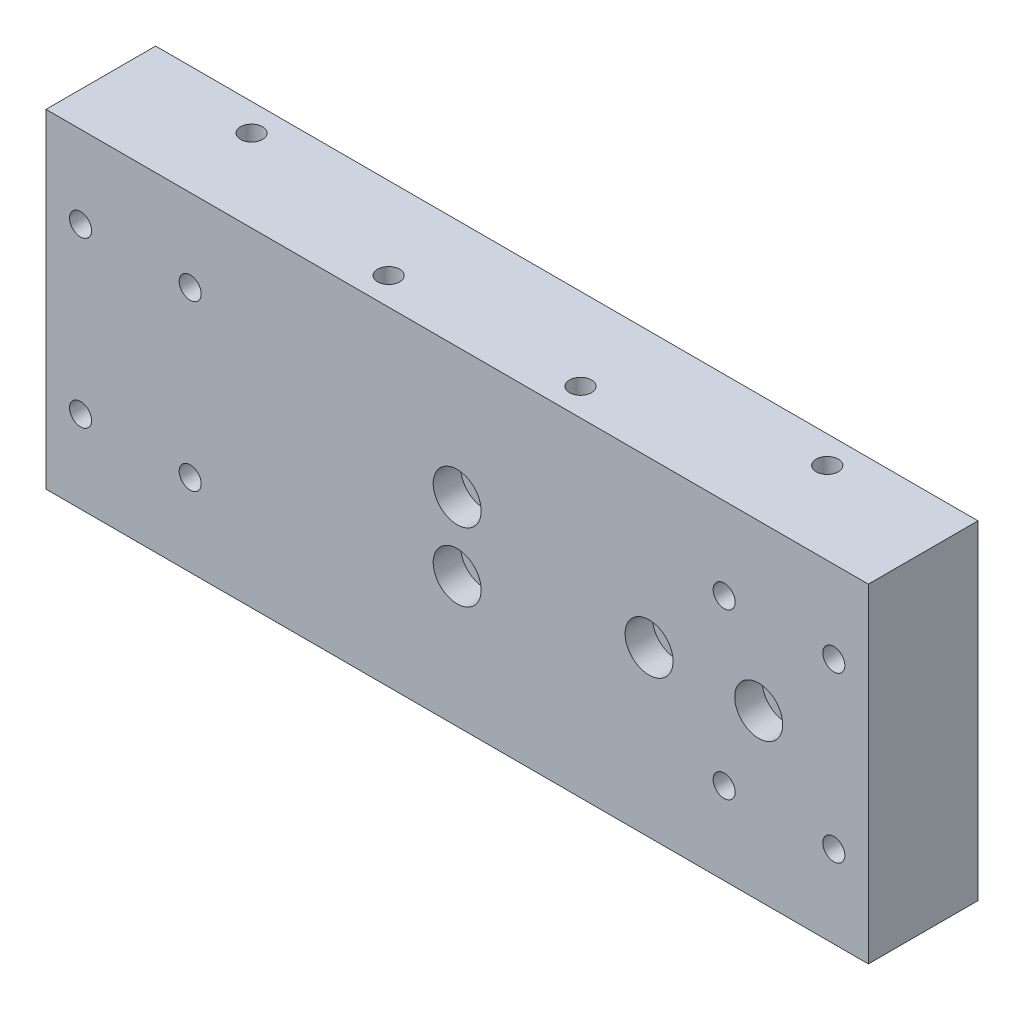
from build123d import *

# Parameters (mm, degrees)
SKETCH1_W                                            = 190.5
SKETCH1_H                                            = 76.2
EXTRUDE1_DEPTH                                       = 12.7
SIDE_1_4_20_TAPPED_HOLE_MASTER_AT_2_COUNT            = 2
SIDE_1_4_20_TAPPED_HOLE_MASTER_AT_2_PITCH            = 46.228697797
TOP_1_4_20_TAPPED_HOES_D                             = 5.1054
BUSIHING_FLEXURE_COUPLING_1_4_20_BOLT_HO_D           = 6.7564
BUSIHING_FLEXURE_COUPLING_1_4_20_BOLT_HO_CBORE_D     = 11.1125
BUSIHING_FLEXURE_COUPLING_1_4_20_BOLT_HO_CBORE_DEPTH = 6.35
LEAD_SCREW_1_4_CAP_SCREW_MOUNTS_D                    = 6.7564
LEAD_SCREW_1_4_CAP_SCREW_MOUNTS_CBORE_D              = 11.1125
LEAD_SCREW_1_4_CAP_SCREW_MOUNTS_CBORE_DEPTH          = 6.35


with BuildPart() as part:
    # Sketch1 → Extrude1 (new, symmetric)
    with BuildSketch(Plane.XY):
        Rectangle(SKETCH1_W, SKETCH1_H)
    extrude(amount=EXTRUDE1_DEPTH, both=True)

    # Sketch10 → Side-1/4-20 tapped hole master (revolve, cut)
    with BuildSketch(Plane(origin=(22.225, -38.1, 6.35), x_dir=(0, 0, -1), z_dir=(1, 0, 0))):
        Polygon((0, 0), (0, 20.583816902), (2.5527, 19.05), (2.5527, 0), align=None)
    side_1_4_20_tapped_hole_master = revolve(axis=Axis((22.225, -44.45, 6.35), (0, 1, 0)), mode=Mode.SUBTRACT)

    # Side-1/4-20 tapped hole master at 2: Side-1/4-20 tapped hole master ×2
    with Locations(*[Vector(0.9615239476408232, 0, -0.27472112789737807) * (i * SIDE_1_4_20_TAPPED_HOLE_MASTER_AT_2_PITCH) for i in range(1, SIDE_1_4_20_TAPPED_HOLE_MASTER_AT_2_COUNT)]):
        add(side_1_4_20_tapped_hole_master, mode=Mode.SUBTRACT)

    # Side-1/4-20 tapped hole mirror I: Side-1/4-20 tapped hole master across plane
    add(side_1_4_20_tapped_hole_master.mirror(Plane(origin=(0, 0, 0), x_dir=(0, 0, 1), z_dir=(1, 0, 0))), mode=Mode.SUBTRACT)

    # Side-1/4-20 tapped hole mirror I copy 1 → Side-1/4-20 tapped hole mirror I cop 2 (revolve, cut)
    with BuildSketch(Plane(origin=(-66.675, -38.1, -6.35), x_dir=(0, 0, -1), z_dir=(-1, 0, 0))):
        Polygon((0, 0), (0, -20.583816902), (2.5527, -19.05), (2.5527, 0), align=None)
    revolve(axis=Axis((-66.675, -44.45, -6.35), (0, -1, 0)), mode=Mode.SUBTRACT)

    # Side-1/4-20 tapped hole mirror II: Side-1/4-20 tapped hole master across plane
    add(side_1_4_20_tapped_hole_master.mirror(Plane.ZX), mode=Mode.SUBTRACT)

    # Side-1/4-20 tapped hole mirror II copy 1 → Side-1/4-20 tapped hole mirror II co 2 (revolve, cut)
    with BuildSketch(Plane(origin=(66.675, 38.1, -6.35), x_dir=(0, 0, -1), z_dir=(1, 0, 0))):
        Polygon((0, 0), (0, -20.583816902), (2.5527, -19.05), (2.5527, 0), align=None)
    revolve(axis=Axis((66.675, 44.45, -6.35), (0, 1, 0)), mode=Mode.SUBTRACT)

    # Side-1/4-20 tapped hole mirror II copy 2 → Side-1/4-20 tapped hole mirror II co 3 (revolve, cut)
    with BuildSketch(Plane(origin=(-22.225, 38.1, 6.35), x_dir=(0, 0, -1), z_dir=(-1, 0, 0))):
        Polygon((0, 0), (0, 20.583816902), (2.5527, 19.05), (2.5527, 0), align=None)
    revolve(axis=Axis((-22.225, 44.45, 6.35), (0, -1, 0)), mode=Mode.SUBTRACT)

    # Side-1/4-20 tapped hole mirror II copy 3 → Side-1/4-20 tapped hole mirror II co 4 (revolve, cut)
    with BuildSketch(Plane(origin=(-66.675, 38.1, -6.35), x_dir=(0, 0, -1), z_dir=(-1, 0, 0))):
        Polygon((0, 0), (0, 20.583816902), (2.5527, 19.05), (2.5527, 0), align=None)
    revolve(axis=Axis((-66.675, 44.45, -6.35), (0, -1, 0)), mode=Mode.SUBTRACT)

    # Top-1/4-20 tapped hoes (through all)
    with Locations(Plane.XY.offset(12.7)):
        with Locations((-61.849, 19.05), (-61.849, -19.05), (-87.249, 19.05), (-87.249, -19.05), (87.249, 19.05), (87.249, -19.05), (61.849, 19.05), (61.849, -19.05)):
            Hole(TOP_1_4_20_TAPPED_HOES_D / 2)

    # Busihing flexure coupling 1/4-20 bolt holes (through all)
    with Locations(Plane(origin=(-12.155752838, -9.35929282, 12.7), x_dir=(-1, 0, 0), z_dir=(0, 0, 1))):
        with Locations((-56.605752838, -9.35929282), (-82.005752838, -9.35929282)):
            CounterBoreHole(BUSIHING_FLEXURE_COUPLING_1_4_20_BOLT_HO_D / 2, BUSIHING_FLEXURE_COUPLING_1_4_20_BOLT_HO_CBORE_D / 2, BUSIHING_FLEXURE_COUPLING_1_4_20_BOLT_HO_CBORE_DEPTH)

    # Lead screw 1/4 cap screw mounts (through all)
    with Locations(Plane(origin=(36.480699887, 13.8528382, 12.7), x_dir=(-1, 0, 0), z_dir=(0, 0, 1))):
        with Locations((36.480699887, 5.9153382), (36.480699887, 21.7903382)):
            CounterBoreHole(LEAD_SCREW_1_4_CAP_SCREW_MOUNTS_D / 2, LEAD_SCREW_1_4_CAP_SCREW_MOUNTS_CBORE_D / 2, LEAD_SCREW_1_4_CAP_SCREW_MOUNTS_CBORE_DEPTH)


solid = part.part
